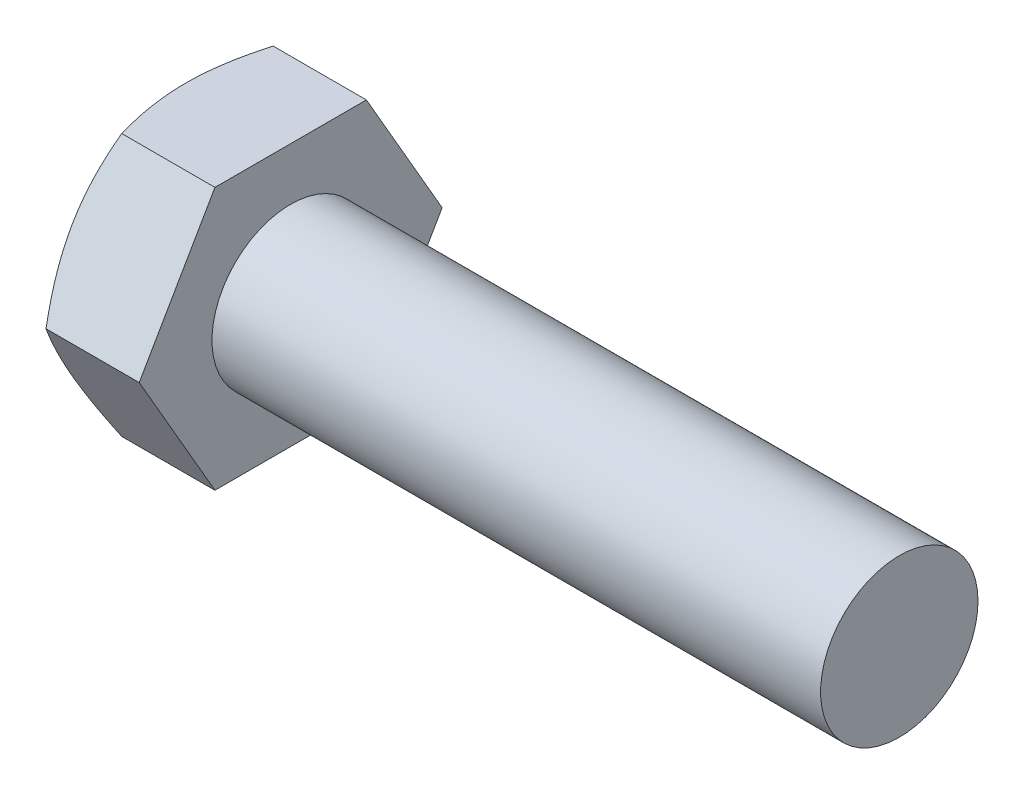
from build123d import *

# Parameters (mm, degrees)
SKETCH2_R           = 3
BOSS_EXTRUDE1_DEPTH = 23.2
BOSS_EXTRUDE2_DEPTH = 4


with BuildPart() as part:
    # Sketch2 → Boss-Extrude1 (new body)
    with BuildSketch(Plane(origin=(0, 0, 0), x_dir=(0, 0, -1), z_dir=(1, 0, 0))):
        Circle(SKETCH2_R)
    extrude(amount=BOSS_EXTRUDE1_DEPTH)

    # Sketch3 → Boss-Extrude2 (add)
    with BuildSketch(Plane.ZY):
        Polygon((5.773502692, 0), (2.886751346, 5), (-2.886751346, 5), (-5.773502692, 0), (-2.886751346, -5), (2.886751346, -5), align=None)
    extrude(amount=BOSS_EXTRUDE2_DEPTH)

    # Sketch5 → Cut-Revolve1 (revolve, cut)
    with BuildSketch(Plane(origin=(0, 0, 0), x_dir=(1, 0, 0), z_dir=(0, 1, 0))):
        Polygon((-4, 5), (-4, 5.773502692), (-3.553418013, 5.773502692), align=None)
    revolve(axis=Axis((23.2, 0, 0), (-1, 0, 0)), mode=Mode.SUBTRACT)


solid = part.part
